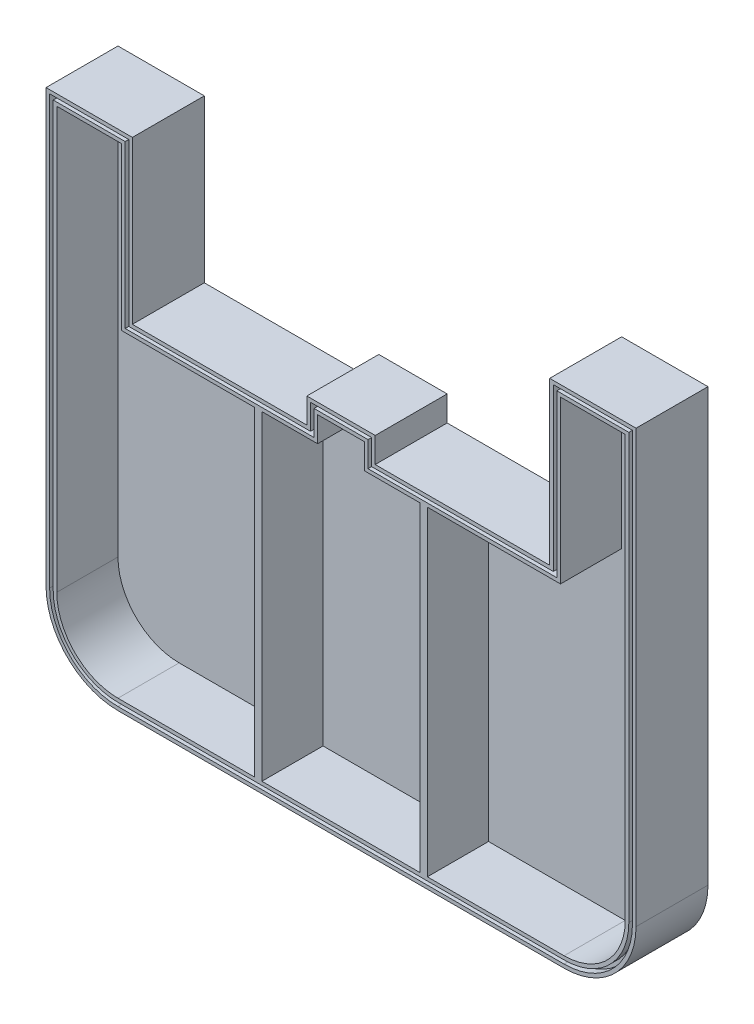
from build123d import *

# Parameters (mm, degrees)
RESSALTO_EXTRUS_O1_DEPTH = 20
CASCA1_T                 = -3
ESBO_O2_W                = 2
ESBO_O2_H                = 89
RESSALTO_EXTRUS_O2_DEPTH = 17
ESBO_O3_R                = 4
CORTE_EXTRUS_O1_DEPTH    = 111.440028975
ESBO_O4_R                = 4
CORTE_EXTRUS_O2_DEPTH    = 44
CORTE_EXTRUS_O3_DEPTH    = 2


with BuildPart() as part:
    # Esboço1 → Ressalto-extrusão1 (new body)
    with BuildSketch(Plane.XY):
        with BuildLine():
            Line((-58, 23), (-58, 68))
            Line((-58, 68), (-82, 68))
            Line((-82, 68), (-82, -52))
            ThreePointArc((-82, -52), (-76.142135624, -66.142135624), (-62, -72))
            Line((-62, -72), (62, -72))
            ThreePointArc((62, -72), (76.142135624, -66.142135624), (82, -52))
            Line((82, -52), (82, 68))
            Line((82, 68), (58, 68))
            Line((58, 68), (58, 23))
            Line((58, 23), (9.5, 23))
            Line((9.5, 23), (9.5, 30))
            Line((9.5, 30), (-9.5, 30))
            Line((-9.5, 30), (-9.5, 23))
            Line((-9.5, 23), (-58, 23))
        make_face()
    extrude(amount=RESSALTO_EXTRUS_O1_DEPTH)

    # Casca1
    casca1_openings = [part.faces().sort_by_distance(p)[0] for p in [
        (0, -15.157706838, 20),
    ]]
    offset(amount=CASCA1_T, openings=casca1_openings, kind=Kind.INTERSECTION)

    # Esboço2 → Ressalto-extrusão2 (add)
    with BuildSketch(Plane.XY.offset(3)):
        with Locations((-23, -24.5)):
            Rectangle(ESBO_O2_W, ESBO_O2_H)
        with Locations((23, -24.5)):
            Rectangle(ESBO_O2_W, ESBO_O2_H)
    extrude(amount=RESSALTO_EXTRUS_O2_DEPTH)

    # Esboço3 → Corte-extrusão1 (cut, through all)
    with BuildSketch(Plane.XY.offset(3)):
        with Locations((70, 55)):
            Circle(ESBO_O3_R)
    extrude(amount=-CORTE_EXTRUS_O1_DEPTH, mode=Mode.SUBTRACT)

    # Esboço4 → Corte-extrusão2 (cut)
    with BuildSketch(Plane.XY.offset(3)):
        with Locations((-70, 55)):
            Circle(ESBO_O4_R)
    extrude(amount=-CORTE_EXTRUS_O2_DEPTH, mode=Mode.SUBTRACT)

    # Esboço5 → Corte-extrusão3 (cut)
    with BuildSketch(Plane.XY.offset(20)):
        with BuildLine():
            Line((-8.5, 22), (-59, 22))
            Line((-59, 22), (-59, 67))
            Line((-59, 67), (-81, 67))
            Line((-81, 67), (-81, -52))
            ThreePointArc((-81, -52), (-75.435028843, -65.435028843), (-62, -71))
            Line((-62, -71), (62, -71))
            ThreePointArc((62, -71), (75.435028843, -65.435028843), (81, -52))
            Line((81, -52), (81, 67))
            Line((81, 67), (59, 67))
            Line((59, 67), (59, 22))
            Line((59, 22), (8.5, 22))
            Line((8.5, 22), (8.5, 29))
            Line((8.5, 29), (-8.5, 29))
            Line((-8.5, 29), (-8.5, 22))
        make_face()
        with BuildLine():
            Line((-62, -70), (62, -70))
            ThreePointArc((62, -70), (74.727922061, -64.727922061), (80, -52))
            Line((80, -52), (80, 66))
            Line((80, 66), (60, 66))
            Line((60, 66), (60, 21))
            Line((60, 21), (7.5, 21))
            Line((7.5, 21), (7.5, 28))
            Line((7.5, 28), (-7.5, 28))
            Line((-7.5, 28), (-7.5, 21))
            Line((-7.5, 21), (-60, 21))
            Line((-60, 21), (-60, 66))
            Line((-60, 66), (-80, 66))
            Line((-80, 66), (-80, -52))
            ThreePointArc((-80, -52), (-74.727922061, -64.727922061), (-62, -70))
        make_face(mode=Mode.SUBTRACT)
    extrude(amount=-CORTE_EXTRUS_O3_DEPTH, mode=Mode.SUBTRACT)


solid = part.part
